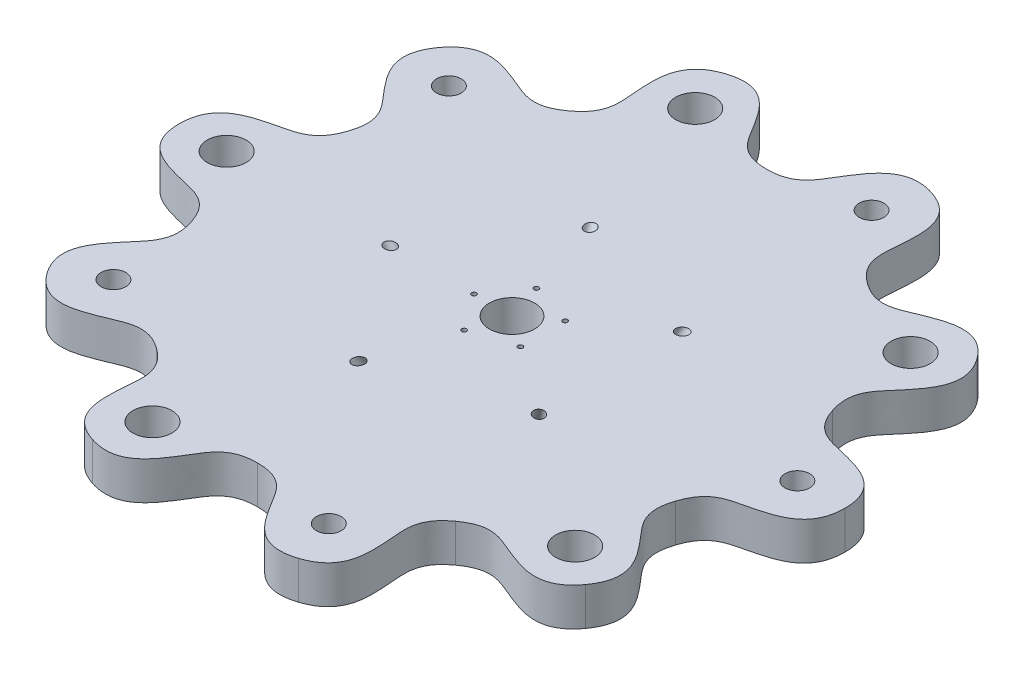
from build123d import *

# Parameters (mm, degrees)
FUEL_HOLES_REACH    = 74.509
FUEL_START          = 5
SKETCH2_R           = 0.5
CIRPATTERN1_COUNT   = 5
SKETCH19_R          = 70
SKETCH19_R_2        = 47.4
BOSS_EXTRUDE2_DEPTH = 8
BOLT_HOLES_REACH    = 101.318
SKETCH19_3_R        = 4.1
SKETCH19_3_R_2      = 2.6
GROOVES_DEPTH       = 100.317672143
CUT_EXTRUDE7_START  = -10
SKETCH41_R          = 1.15
CUT_EXTRUDE7_DEPTH  = 111.877528739
CIRPATTERN9_COUNT   = 5
CIRPATTERN10_COUNT  = 5
CIRPATTERN11_COUNT  = 10
SKETCH32_R          = 4.75
M11TAP_DEPTH        = 98.328392822


with BuildPart() as part:
    # Sketch1 → Revolve1 (revolve)
    with BuildSketch(Plane.XY):
        Polygon((-47.4, 0), (-47.4, -8), (-17.4, -8), (-7, -8), (0, -8), (0, 0), align=None)
    revolve(axis=Axis((0, -8, 0), (0, 1, 0)))

    # Sketch2 → Fuel holes (cut, up to next)
    with BuildSketch(Plane(origin=(0, 0, 0), x_dir=(1, 0, 0), z_dir=(0, 1, 0)).offset(FUEL_START), mode=Mode.PRIVATE) as fuel_holes_sk1:
        with Locations((-8, 0)):
            Circle(SKETCH2_R)
    fuel_holes_tool1 = extrude(fuel_holes_sk1.sketch, amount=-FUEL_HOLES_REACH, mode=Mode.PRIVATE) & part.part
    fuel_holes = fuel_holes_tool1.solids().sort_by_distance((-8, 5, 0))[0]
    add(fuel_holes, mode=Mode.SUBTRACT)

    # CirPattern1: Fuel holes ×5 about axis
    cirpattern1_axis = Axis((0, 0, 0), (0, 1, 0))
    for i in range(1, CIRPATTERN1_COUNT):
        add(fuel_holes.rotate(cirpattern1_axis, i * 360 / CIRPATTERN1_COUNT), mode=Mode.SUBTRACT)

    # Sketch19 → Boss-Extrude2 (add)
    with BuildSketch(Plane.XZ.offset(8)):
        Circle(SKETCH19_R)
        Circle(SKETCH19_R_2, mode=Mode.SUBTRACT)
    extrude(amount=-BOSS_EXTRUDE2_DEPTH)

    # Sketch19<3> → Bolt holes (cut, up to next)
    with BuildSketch(Plane.XZ.offset(8), mode=Mode.PRIVATE) as bolt_holes_sk1:
        with Locations((-60, 0)):
            Circle(SKETCH19_3_R)
    bolt_holes_tool1 = extrude(bolt_holes_sk1.sketch, amount=-BOLT_HOLES_REACH, mode=Mode.PRIVATE) & part.part
    # Sketch19<3> → Bolt holes (cut, up to next)
    with BuildSketch(Plane.XZ.offset(8), mode=Mode.PRIVATE) as bolt_holes_sk2:
        with Locations((-48.541019662, -35.267115138)):
            Circle(SKETCH19_3_R_2)
    bolt_holes_tool2 = extrude(bolt_holes_sk2.sketch, amount=-BOLT_HOLES_REACH, mode=Mode.PRIVATE) & part.part
    bolt_holes_1 = bolt_holes_tool1.solids().sort_by_distance((-60, -8, 0))[0]
    add(bolt_holes_1, mode=Mode.SUBTRACT)
    bolt_holes_2 = bolt_holes_tool2.solids().sort_by_distance((-48.54102, -8, -35.267115))[0]
    add(bolt_holes_2, mode=Mode.SUBTRACT)
    bolt_holes = bolt_holes_1 + bolt_holes_2  # Bolt holes as one shape, for the pattern or mirror that repeats it

    # Sketch19<8> → Grooves (cut, through all)
    with BuildSketch(Plane.XZ.offset(8)):
        with BuildLine():
            add(Edge.make_bspline(
                [(-50.881523622, -16.532409199), (-49.313921303, -21.356993048), (-54.157165819, -27.536733412), (-61.186304326, -34.875390114), (-56.631189606, -41.14496766)],
                knots=[0, 0, 0, 0, 0.376165708, 1, 1, 1, 1], degree=3))
            add(Edge.make_bspline(
                [(-50.881523622, -16.532409199), (-52.44912594, -11.70782535), (-59.999753311, -9.555098074), (-70, -7.749624037), (-70, 0)],
                knots=[0, 0, 0, 0, 0.376165708, 1, 1, 1, 1], degree=3))
            ThreePointArc((-70, 0), (-66.573956141, -21.631189606), (-56.631189606, -41.14496766))
        make_face()
    grooves = extrude(amount=-GROOVES_DEPTH, mode=Mode.SUBTRACT)

    # Sketch41 → Cut-Extrude7 (cut)
    with BuildSketch(Plane(origin=(-1.785898385, 3.09326674, 0), x_dir=(0, 0, -1), z_dir=(0.499999999999998, -0.8660254037844398, 0)).offset(CUT_EXTRUDE7_START)):
        with Locations((0, -22.186533479)):
            Circle(SKETCH41_R)
    cut_extrude7 = extrude(amount=CUT_EXTRUDE7_DEPTH, mode=Mode.SUBTRACT)

    # CirPattern9: Cut-Extrude7 ×5 about axis
    cirpattern9_axis = Axis((0, 0, 0), (0, 1, 0))
    for i in range(1, CIRPATTERN9_COUNT):
        add(cut_extrude7.rotate(cirpattern9_axis, i * 360 / CIRPATTERN9_COUNT), mode=Mode.SUBTRACT)

    # CirPattern10: Bolt holes ×5 about axis
    cirpattern10_axis = Axis((0, 0, 0), (0, 1, 0))
    for i in range(1, CIRPATTERN10_COUNT):
        add(bolt_holes.rotate(cirpattern10_axis, i * 360 / CIRPATTERN10_COUNT), mode=Mode.SUBTRACT)

    # CirPattern11: Grooves ×10 about axis
    cirpattern11_axis = Axis((0, 0, 0), (0, 1, 0))
    for i in range(1, CIRPATTERN11_COUNT):
        add(grooves.rotate(cirpattern11_axis, i * 360 / CIRPATTERN11_COUNT), mode=Mode.SUBTRACT)

    # Sketch32 → M11Tap (cut, through all)
    with BuildSketch(Plane(origin=(0, 0, 0), x_dir=(1, 0, 0), z_dir=(0, 1, 0))):
        Circle(SKETCH32_R)
    extrude(amount=-M11TAP_DEPTH, mode=Mode.SUBTRACT)


solid = part.part
